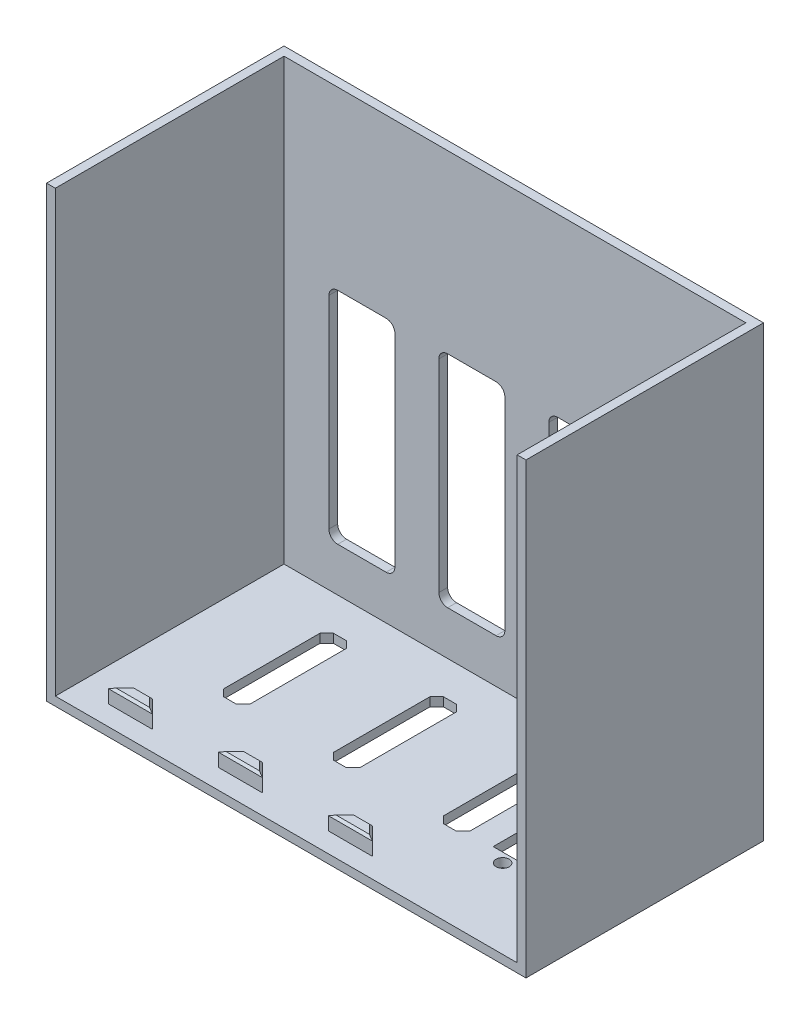
from build123d import *

# Parameters (mm, degrees)
BOSS_EXTRUDE1_DEPTH = 105
SKETCH3_W           = 54
SKETCH3_H           = 102
BOSS_EXTRUDE2_DEPTH = 2
BOSS_EXTRUDE3_START = -105
SKETCH3_2_W         = 54
SKETCH3_2_H         = 102
BOSS_EXTRUDE3_DEPTH = 2
BOSS_EXTRUDE4_DEPTH = 3.5
CHAMFER1_SIZE       = 0.5
SKETCH5_W           = 15
SKETCH5_H           = 50
CUT_EXTRUDE1_DEPTH  = 158.381701605
SKETCH7_W           = 6
SKETCH7_H           = 25
CUT_EXTRUDE2_DEPTH  = 158.381701605
FILLET1_R           = 2
CHAMFER2_SIZE       = 1.5
SKETCH8_R           = 1.5
SKETCH8_W           = 7.2
SKETCH8_H           = 7.7
SKETCH8_H_2         = 10.7
CUT_EXTRUDE3_DEPTH  = 158.381701605


with BuildPart() as part:
    # Sketch1 → Boss-Extrude1 (new body)
    with BuildSketch(Plane(origin=(0, 0, 0), x_dir=(0, 0, -1), z_dir=(1, 0, 0))):
        Polygon((0, 0), (54, 0), (54, 102), (52, 102), (52, 2), (0, 2), align=None)
    extrude(amount=BOSS_EXTRUDE1_DEPTH)

    # Sketch3 → Boss-Extrude2 (add)
    with BuildSketch(Plane(origin=(105, 0, 0), x_dir=(0, 0, -1), z_dir=(1, 0, 0))):
        with Locations((27, 51)):
            Rectangle(SKETCH3_W, SKETCH3_H)
    extrude(amount=BOSS_EXTRUDE2_DEPTH)

    # Sketch3<2> → Boss-Extrude3 (add)
    with BuildSketch(Plane(origin=(105, 0, 0), x_dir=(0, 0, -1), z_dir=(1, 0, 0)).offset(BOSS_EXTRUDE3_START)):
        with Locations((27, 51)):
            Rectangle(SKETCH3_2_W, SKETCH3_2_H)
    extrude(amount=-BOSS_EXTRUDE3_DEPTH)

    # Sketch4 → Boss-Extrude4 (add)
    with BuildSketch(Plane.XZ.offset(-2)):
        Polygon((42.6, -4.5), (39.6, -7.5), (35.6, -7.5), (32.6, -4.5), align=None)
        Polygon((17.6, -4.5), (14.6, -7.5), (10.6, -7.5), (7.6, -4.5), align=None)
        Polygon((67.6, -4.5), (64.6, -7.5), (60.6, -7.5), (57.6, -4.5), align=None)
    extrude(amount=-BOSS_EXTRUDE4_DEPTH)

    # Chamfer1
    chamfer1_edges = [part.edges().sort_by_distance(p)[0] for p in [
        (12.6, 5.5, -4.5),
        (16.1, 5.5, -6),
        (12.6, 5.5, -7.5),
        (9.1, 5.5, -6),
        (37.6, 5.5, -4.5),
        (41.1, 5.5, -6),
        (37.6, 5.5, -7.5),
        (34.1, 5.5, -6),
        (62.6, 5.5, -4.5),
        (66.1, 5.5, -6),
        (62.6, 5.5, -7.5),
        (59.1, 5.5, -6),
    ]]
    chamfer(chamfer1_edges, length=CHAMFER1_SIZE)

    # Sketch5 → Cut-Extrude1 (cut, through all)
    with BuildSketch(Plane(origin=(0, 0, -54), x_dir=(-1, 0, 0), z_dir=(0, 0, -1))):
        with Locations((-42.7, 37)):
            Rectangle(SKETCH5_W, SKETCH5_H)
        with Locations((-17.7, 37)):
            Rectangle(SKETCH5_W, SKETCH5_H)
        with Locations((-67.7, 37)):
            Rectangle(SKETCH5_W, SKETCH5_H)
    extrude(amount=-CUT_EXTRUDE1_DEPTH, mode=Mode.SUBTRACT)

    # Sketch7 → Cut-Extrude2 (cut, through all)
    with BuildSketch(Plane.XZ):
        with Locations((20.7, -31.5)):
            Rectangle(SKETCH7_W, SKETCH7_H)
        with Locations((45.7, -31.5)):
            Rectangle(SKETCH7_W, SKETCH7_H)
        with Locations((70.7, -31.5)):
            Rectangle(SKETCH7_W, SKETCH7_H)
    extrude(amount=-CUT_EXTRUDE2_DEPTH, mode=Mode.SUBTRACT)

    # Fillet1
    fillet1_edges = [part.edges().sort_by_distance(p)[0] for p in [
        (25.2, 12, -53),
        (25.2, 62, -53),
        (10.2, 62, -53),
        (10.2, 12, -53),
        (50.2, 62, -53),
        (35.2, 62, -53),
        (35.2, 12, -53),
        (50.2, 12, -53),
        (75.2, 62, -53),
        (60.2, 62, -53),
        (60.2, 12, -53),
        (75.2, 12, -53),
    ]]
    fillet(fillet1_edges, radius=FILLET1_R)

    # Chamfer2
    chamfer2_edges = [part.edges().sort_by_distance(p)[0] for p in [
        (17.7, 1, -44),
        (17.7, 1, -19),
        (23.7, 1, -19),
        (23.7, 1, -44),
        (48.7, 1, -44),
        (42.7, 1, -44),
        (42.7, 1, -19),
        (48.7, 1, -19),
        (73.7, 1, -44),
        (67.7, 1, -44),
        (67.7, 1, -19),
        (73.7, 1, -19),
    ]]
    chamfer(chamfer2_edges, length=CHAMFER2_SIZE)

    # Sketch8 → Cut-Extrude3 (cut, through all)
    with BuildSketch(Plane(origin=(0, 0, 0), x_dir=(-1, 0, 0), z_dir=(0, -1, 0))):
        with Locations(Location((-83.7, 18, 0), (0, 0, 90))):
            Circle(SKETCH8_R)
        with Locations(Location((-83.7, 38.5, 0), (0, 0, 90))):
            Circle(SKETCH8_R)
        with BuildLine():
            Line((-81.9, 36.35), (-85.5, 36.35))
            ThreePointArc((-85.5, 36.35), (-87.267766953, 35.617766953), (-88, 33.85))
            Line((-88, 33.85), (-88, 20.15))
            Line((-88, 20.15), (-79.4, 20.15))
            Line((-79.4, 20.15), (-79.4, 33.85))
            ThreePointArc((-79.4, 33.85), (-80.132233047, 35.617766953), (-81.9, 36.35))
        make_face()
        with Locations((-98, 18)):
            Rectangle(SKETCH8_W, SKETCH8_H)
        with Locations((-98, 36)):
            Rectangle(SKETCH8_W, SKETCH8_H_2)
    extrude(amount=-CUT_EXTRUDE3_DEPTH, mode=Mode.SUBTRACT)


solid = part.part
